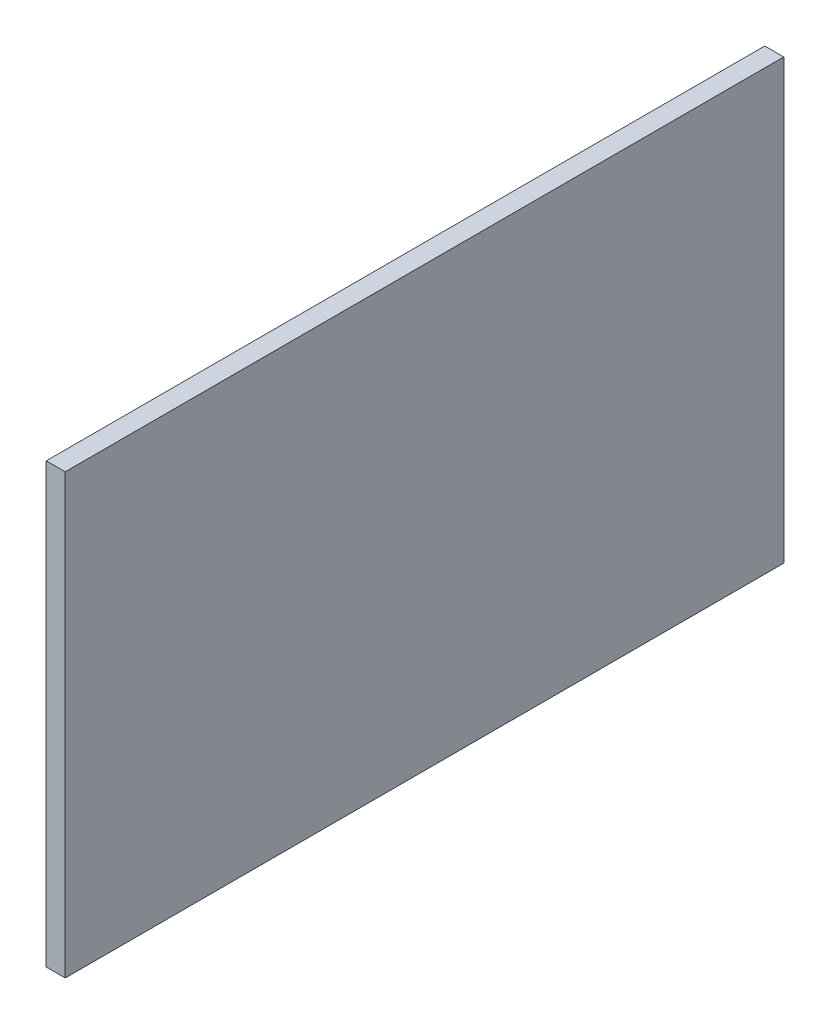
from build123d import *

# Parameters (mm, degrees)
SKETCH1_W           = 454
SKETCH1_H           = 277
BOSS_EXTRUDE1_DEPTH = 12


with BuildPart() as part:
    # Sketch1 → Boss-Extrude1 (new body)
    with BuildSketch(Plane(origin=(0, 0, 0), x_dir=(0, 0, -1), z_dir=(1, 0, 0))):
        with Locations((227, 138.5)):
            Rectangle(SKETCH1_W, SKETCH1_H)
    extrude(amount=BOSS_EXTRUDE1_DEPTH)


solid = part.part
